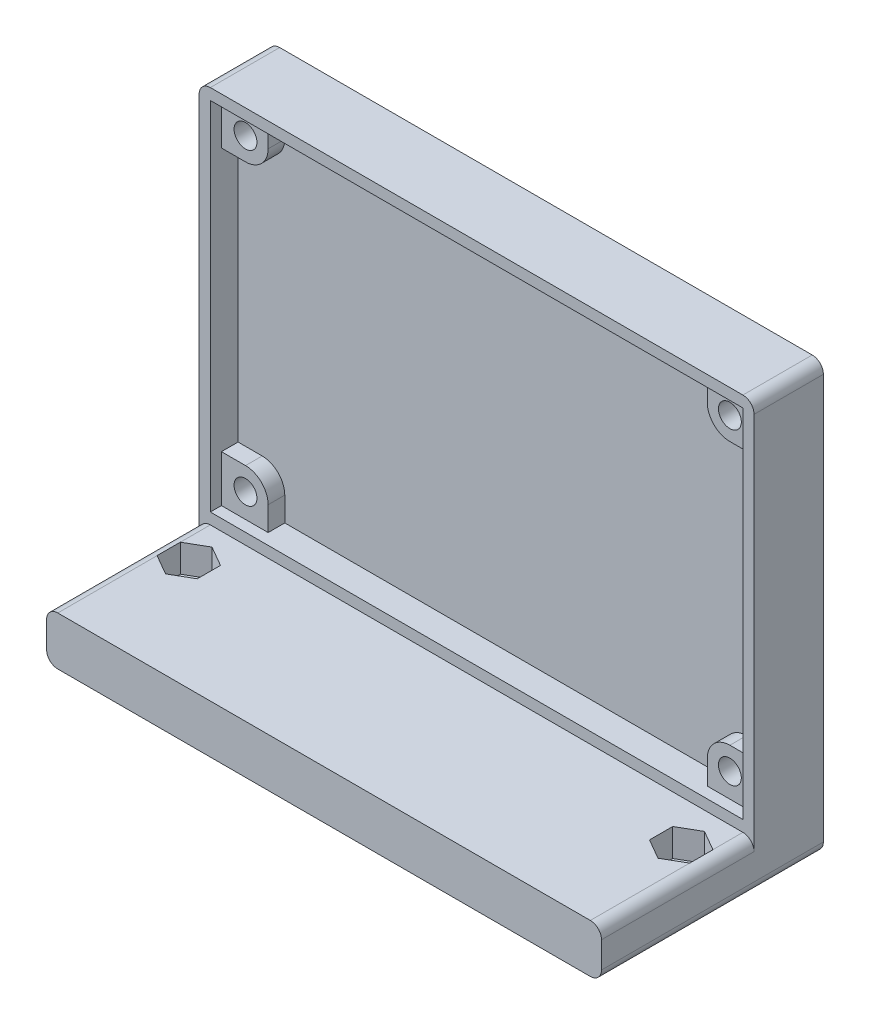
from build123d import *

# Parameters (mm, degrees)
SKETCH1_R           = 1.65
BOSS_EXTRUDE1_DEPTH = 32
CUT_EXTRUDE3_START  = -22
CUT_EXTRUDE3_DEPTH  = 22
CUT_EXTRUDE1_DEPTH  = 26
SKETCH3_W           = 76.8
SKETCH3_H           = 51.4
CUT_EXTRUDE2_DEPTH  = 23.6
CUT_EXTRUDE4_REACH  = 76.888
SKETCH5_R           = 1.65
CUT_EXTRUDE5_DEPTH  = 4


with BuildPart() as part:
    # Sketch1 → Boss-Extrude1 (new body)
    with BuildSketch(Plane.XY):
        with BuildLine():
            Line((-40.01, -32.7), (-40.01, 25.7))
            ThreePointArc((-40.01, 25.7), (-39.538441918, 26.838441918), (-38.4, 27.31))
            Line((-38.4, 27.31), (38.4, 27.31))
            ThreePointArc((38.4, 27.31), (39.538441918, 26.838441918), (40.01, 25.7))
            Line((40.01, 25.7), (40.01, -32.7))
            ThreePointArc((40.01, -32.7), (39.538441918, -33.838441918), (38.4, -34.31))
            Line((38.4, -34.31), (-38.4, -34.31))
            ThreePointArc((-38.4, -34.31), (-39.538441918, -33.838441918), (-40.01, -32.7))
        make_face()
        with Locations((-34.925, 22.225)):
            Circle(SKETCH1_R, mode=Mode.SUBTRACT)
        with Locations((-34.925, -22.225)):
            Circle(SKETCH1_R, mode=Mode.SUBTRACT)
        with Locations((34.925, 22.225)):
            Circle(SKETCH1_R, mode=Mode.SUBTRACT)
        with Locations((34.925, -22.225)):
            Circle(SKETCH1_R, mode=Mode.SUBTRACT)
    extrude(amount=BOSS_EXTRUDE1_DEPTH)

    # Sketch4 → Cut-Extrude3 (cut)
    with BuildSketch(Plane.XY.offset(32).offset(CUT_EXTRUDE3_START)):
        with BuildLine():
            Line((-38.4, -27.31), (38.4, -27.31))
            ThreePointArc((38.4, -27.31), (39.538441918, -27.781558082), (40.01, -28.92))
            Line((40.01, -28.92), (40.01, 25.7))
            ThreePointArc((40.01, 25.7), (39.538441918, 26.838441918), (38.4, 27.31))
            Line((38.4, 27.31), (-38.4, 27.31))
            ThreePointArc((-38.4, 27.31), (-39.538441918, 26.838441918), (-40.01, 25.7))
            Line((-40.01, 25.7), (-40.01, -28.92))
            ThreePointArc((-40.01, -28.92), (-39.538441918, -27.781558082), (-38.4, -27.31))
        make_face()
    extrude(amount=CUT_EXTRUDE3_DEPTH, mode=Mode.SUBTRACT)

    # Sketch2 → Cut-Extrude1 (cut)
    with BuildSketch(Plane.XY.offset(32)):
        with BuildLine():
            Line((-31.665, 25.7), (31.665, 25.7))
            Line((31.665, 25.7), (31.665, 22.225))
            ThreePointArc((31.665, 22.225), (32.619831893, 19.919831893), (34.925, 18.965))
            Line((34.925, 18.965), (38.4, 18.965))
            Line((38.4, 18.965), (38.4, -18.965))
            Line((38.4, -18.965), (34.925, -18.965))
            ThreePointArc((34.925, -18.965), (32.619831893, -19.919831893), (31.665, -22.225))
            Line((31.665, -22.225), (31.665, -25.7))
            Line((31.665, -25.7), (-31.665, -25.7))
            Line((-31.665, -25.7), (-31.665, -22.225))
            ThreePointArc((-31.665, -22.225), (-32.619831893, -19.919831893), (-34.925, -18.965))
            Line((-34.925, -18.965), (-38.4, -18.965))
            Line((-38.4, -18.965), (-38.4, 18.965))
            Line((-38.4, 18.965), (-34.925, 18.965))
            ThreePointArc((-34.925, 18.965), (-32.619831893, 19.919831893), (-31.665, 22.225))
            Line((-31.665, 22.225), (-31.665, 25.7))
        make_face()
    extrude(amount=-CUT_EXTRUDE1_DEPTH, mode=Mode.SUBTRACT)

    # Sketch3 → Cut-Extrude2 (cut)
    with BuildSketch(Plane.XY.offset(32)):
        Rectangle(SKETCH3_W, SKETCH3_H)
    extrude(amount=-CUT_EXTRUDE2_DEPTH, mode=Mode.SUBTRACT)

    # Sketch5 → Cut-Extrude4 (cut, up to next)
    with BuildSketch(Plane(origin=(0, -27.31, 0), x_dir=(1, 0, 0), z_dir=(0, 1, 0)), mode=Mode.PRIVATE) as cut_extrude4_sk1:
        with Locations(Location((-35.51, -16, 0), (0, 0, 180))):
            Circle(SKETCH5_R)
    cut_extrude4_tool1 = extrude(cut_extrude4_sk1.sketch, amount=-CUT_EXTRUDE4_REACH, mode=Mode.PRIVATE) & part.part
    # Sketch5 → Cut-Extrude4 (cut, up to next)
    with BuildSketch(Plane(origin=(0, -27.31, 0), x_dir=(1, 0, 0), z_dir=(0, 1, 0)), mode=Mode.PRIVATE) as cut_extrude4_sk2:
        with Locations(Location((35.51, -16, 0), (0, 0, 180))):
            Circle(SKETCH5_R)
    cut_extrude4_tool2 = extrude(cut_extrude4_sk2.sketch, amount=-CUT_EXTRUDE4_REACH, mode=Mode.PRIVATE) & part.part
    add(cut_extrude4_tool1.solids().sort_by_distance((-35.51, -27.31, 16))[0], mode=Mode.SUBTRACT)
    add(cut_extrude4_tool2.solids().sort_by_distance((35.51, -27.31, 16))[0], mode=Mode.SUBTRACT)

    # Sketch6 → Cut-Extrude5 (cut)
    with BuildSketch(Plane(origin=(0, -27.31, 0), x_dir=(1, 0, 0), z_dir=(0, 1, 0))):
        Polygon((-35.51, -19.348631561), (-32.61, -17.674315781), (-32.61, -14.325684219), (-35.51, -12.651368439), (-38.41, -14.325684219), (-38.41, -17.674315781), align=None)
        Polygon((35.51, -19.348631561), (38.41, -17.674315781), (38.41, -14.325684219), (35.51, -12.651368439), (32.61, -14.325684219), (32.61, -17.674315781), align=None)
    extrude(amount=-CUT_EXTRUDE5_DEPTH, mode=Mode.SUBTRACT)


solid = part.part
